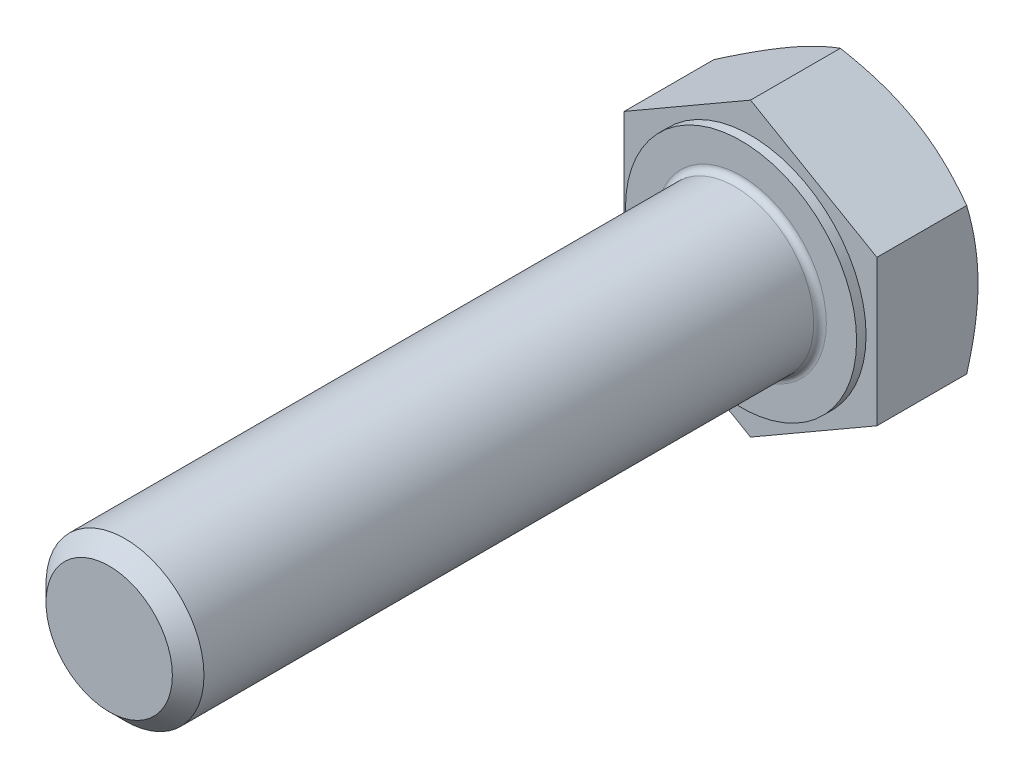
from build123d import *

# Parameters (mm, degrees)
VYSUNOUT1_DEPTH = 6.4
SKICA3_R        = 7.315
VYSUNOUT2_DEPTH = 0.6
SKICA4_R        = 5
VYSUNOUT3_DEPTH = 40
ZKOSIT1_SIZE    = 1
ZAOBLIT1_R      = 0.4


with BuildPart() as part:
    # Skica1 → Vysunout1 (new body)
    with BuildSketch(Plane.XY):
        Polygon((8, -4.618802154), (8, 4.618802154), (0, 9.237604307), (-8, 4.618802154), (-8, -4.618802154), (0, -9.237604307), align=None)
    extrude(amount=VYSUNOUT1_DEPTH)

    # Skica2 → Odebrat otočením1 (revolve, cut)
    with BuildSketch(Plane(origin=(0, 0, 0), x_dir=(1, 0, 0), z_dir=(0, 1, 0))):
        Polygon((8, 0), (19.085125168, 0), (19.085125168, -6.4), align=None)
    revolve(axis=Axis((0, 0, 0), (0, 0, 1)), mode=Mode.SUBTRACT)

    # Skica3 → Vysunout2 (add)
    with BuildSketch(Plane.XY.offset(6.4)):
        Circle(SKICA3_R)
    extrude(amount=VYSUNOUT2_DEPTH)

    # Skica4 → Vysunout3 (add)
    with BuildSketch(Plane.XY.offset(7)):
        Circle(SKICA4_R)
    extrude(amount=VYSUNOUT3_DEPTH)

    # Zkosit1
    zkosit1_edges = [part.edges().sort_by_distance(p)[0] for p in [
        (-5, 0, 47),
    ]]
    chamfer(zkosit1_edges, length=ZKOSIT1_SIZE)

    # Zaoblit1
    zaoblit1_edges = [part.edges().sort_by_distance(p)[0] for p in [
        (-5, 0, 7),
    ]]
    fillet(zaoblit1_edges, radius=ZAOBLIT1_R)


solid = part.part
